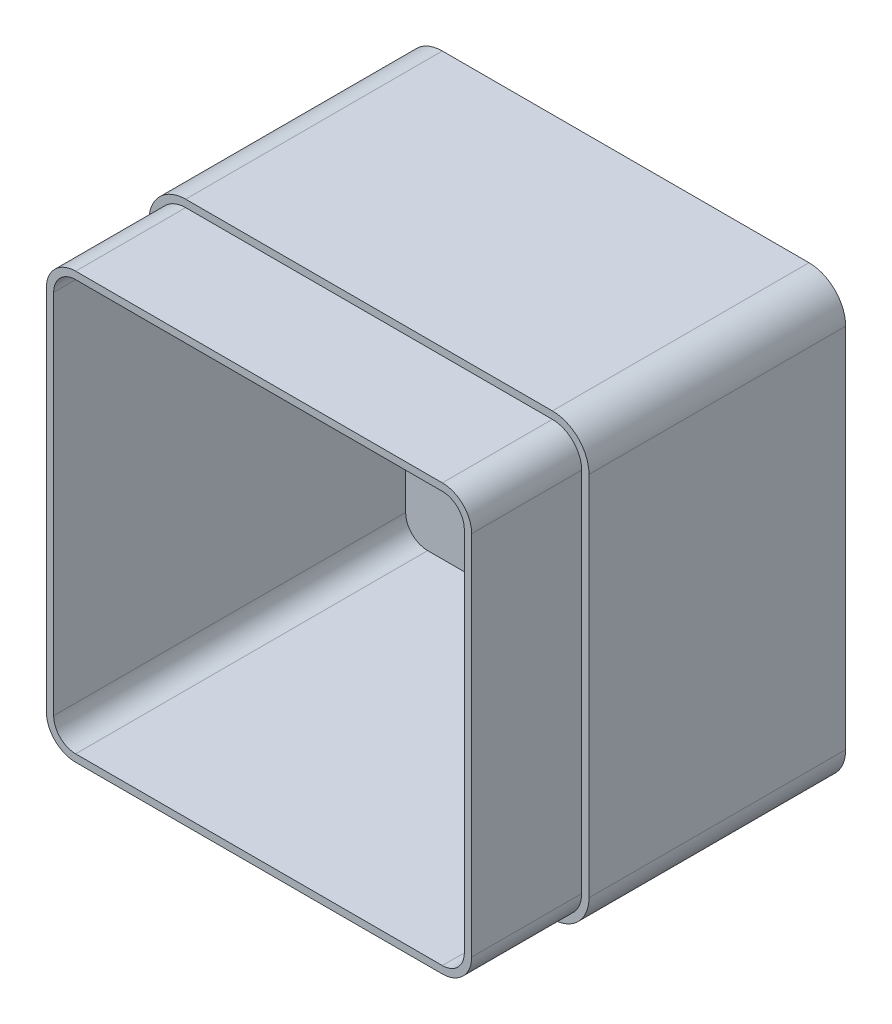
from build123d import *

# Parameters (mm, degrees)
SKETCH1_W           = 120
SKETCH1_H           = 120
BOSS_EXTRUDE2_DEPTH = 70
FILLET1_R           = 10
SHELL2_T            = -4
BOSS_EXTRUDE3_DEPTH = 30
CUT_EXTRUDE9_DEPTH  = 30


with BuildPart() as part:
    # Sketch1 → Boss-Extrude2 (new body)
    with BuildSketch(Plane.XY):
        Rectangle(SKETCH1_W, SKETCH1_H)
    extrude(amount=BOSS_EXTRUDE2_DEPTH)

    # Fillet1
    fillet1_edges = [part.edges().sort_by_distance(p)[0] for p in [
        (60, -60, 35),
        (-60, -60, 35),
        (-60, 60, 35),
        (60, 60, 35),
    ]]
    fillet(fillet1_edges, radius=FILLET1_R)

    # Shell2
    shell2_openings = [part.faces().sort_by_distance(p)[0] for p in [
        (0, 0, 70),
    ]]
    offset(amount=SHELL2_T, openings=shell2_openings, kind=Kind.INTERSECTION)

    # Sketch12 → Boss-Extrude3 (add)
    with BuildSketch(Plane.XY.offset(70)):
        with BuildLine():
            Line((-58, 50), (-58, -50))
            ThreePointArc((-58, -50), (-55.656854249, -55.656854249), (-50, -58))
            Line((-50, -58), (50, -58))
            ThreePointArc((50, -58), (55.656854249, -55.656854249), (58, -50))
            Line((58, -50), (58, 50))
            ThreePointArc((58, 50), (55.656854249, 55.656854249), (50, 58))
            Line((50, 58), (-50, 58))
            ThreePointArc((-50, 58), (-55.656854249, 55.656854249), (-58, 50))
        make_face()
    extrude(amount=BOSS_EXTRUDE3_DEPTH)

    # Sketch14 → Cut-Extrude9 (cut)
    with BuildSketch(Plane.XY.offset(100)):
        with BuildLine():
            Line((50, 56), (-50, 56))
            ThreePointArc((-50, 56), (-54.242640687, 54.242640687), (-56, 50))
            Line((-56, 50), (-56, -50))
            ThreePointArc((-56, -50), (-54.242640687, -54.242640687), (-50, -56))
            Line((-50, -56), (50, -56))
            ThreePointArc((50, -56), (54.242640687, -54.242640687), (56, -50))
            Line((56, -50), (56, 50))
            ThreePointArc((56, 50), (54.242640687, 54.242640687), (50, 56))
        make_face()
    extrude(amount=-CUT_EXTRUDE9_DEPTH, mode=Mode.SUBTRACT)


solid = part.part
